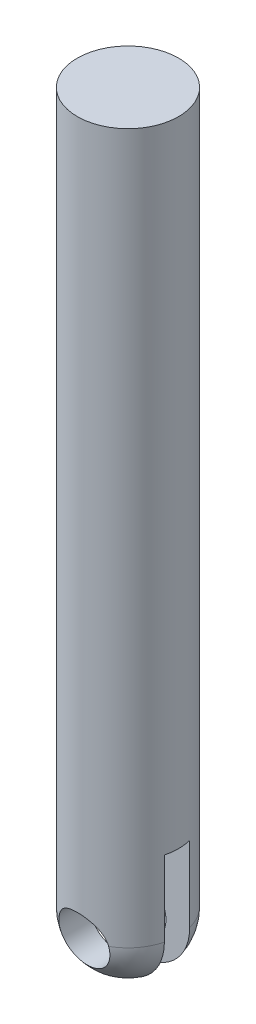
from build123d import *

# Parameters (mm, degrees)
CUT_EXTRUDE1_DEPTH      = 235.048071985
CUT_EXTRUDE1_DEPTH_BACK = 235.048071985
SKETCH2_W               = 5
SKETCH2_H               = 33.382597824
CUT_EXTRUDE2_DEPTH      = 235.048071985
CUT_EXTRUDE2_DEPTH_BACK = 235.048071985
SKETCH3_R               = 5


with BuildPart() as part:
    # Sketch1 → Revolve1 (revolve)
    with BuildSketch(Plane(origin=(0, 0, 2.5), x_dir=(-1, 0, 0), z_dir=(0, 0, -1))):
        with BuildLine():
            Line((0, 233.5), (0, 83.5))
            ThreePointArc((0, 83.5), (7.071067812, 86.428932188), (10, 93.5))
            Line((10, 93.5), (10, 233.5))
            Line((10, 233.5), (0, 233.5))
        make_face()
    revolve(axis=Axis((0, 233.5, 2.5), (0, -1, 0)))

    # Sketch2 → Cut-Extrude1 (cut, two sides: drawn at the far end of the back side and taken through both)
    with BuildSketch(Plane(origin=(0, 0, 0), x_dir=(0, 0, -1), z_dir=(1, 0, 0)).offset(-CUT_EXTRUDE1_DEPTH_BACK)):
        with Locations((-2.5, 91.70929716)):
            Rectangle(SKETCH2_W, SKETCH2_H)
    extrude(amount=CUT_EXTRUDE1_DEPTH + CUT_EXTRUDE1_DEPTH_BACK, mode=Mode.SUBTRACT)

    # Sketch3 → Cut-Extrude2 (cut, two sides: drawn at the far end of the back side and taken through both)
    with BuildSketch(Plane.XY.offset(-CUT_EXTRUDE2_DEPTH_BACK)):
        with Locations(Location((0, 92.5, 0), (0, 0, 11.536959031))):
            Circle(SKETCH3_R)
    extrude(amount=CUT_EXTRUDE2_DEPTH + CUT_EXTRUDE2_DEPTH_BACK, mode=Mode.SUBTRACT)


solid = part.part
